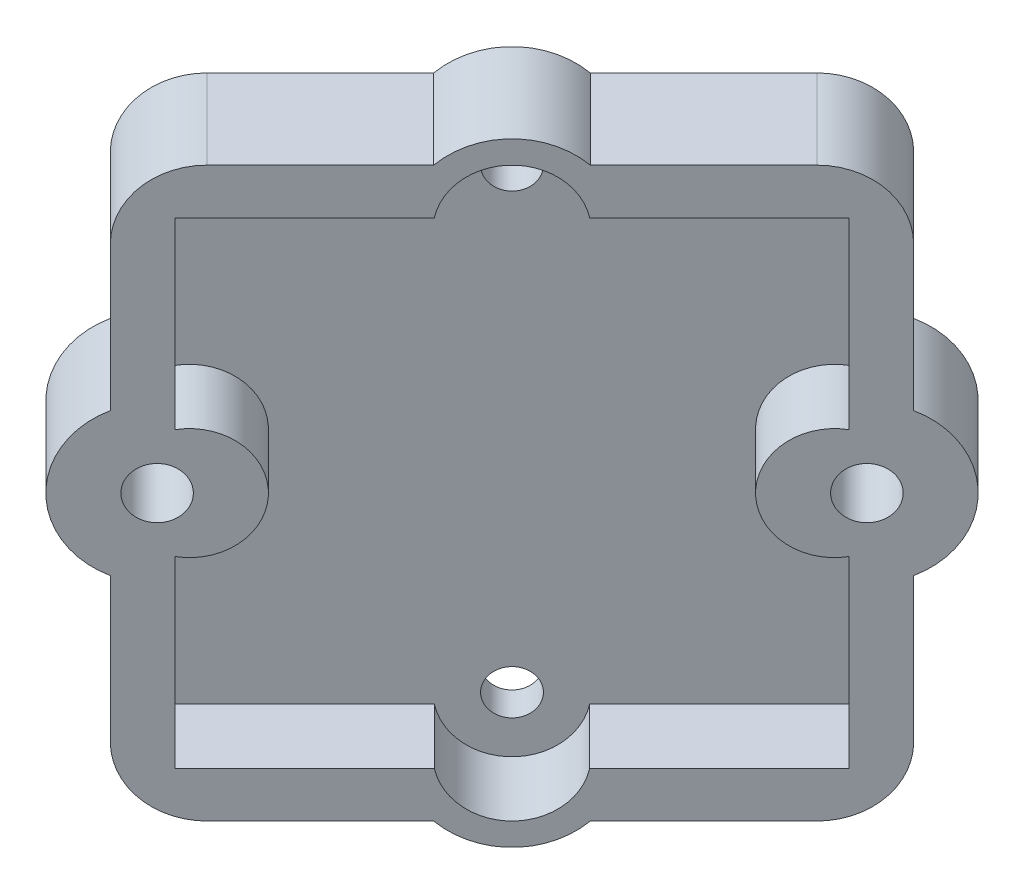
from build123d import *

# Parameters (mm, degrees)
BOSS_EXTRUDE1_DEPTH = 4.95
CUT_EXTRUDE1_DEPTH  = 3.45
CUT_EXTRUDE2_REACH  = 63.277
SKETCH3_R           = 0.975
CUT_EXTRUDE3_REACH  = 63.319
SKETCH4_R           = 1.125


with BuildPart() as part:
    # Sketch1 → Boss-Extrude1 (new body)
    with BuildSketch(Plane(origin=(69.394235316, 0, 69.394235316), x_dir=(0.7071067811865475, 0, -0.7071067811865477), z_dir=(0.7071067811865477, 0, 0.7071067811865475))):
        with BuildLine():
            Line((23.501825189, 8.05), (23.501825189, 14.369504832))
            ThreePointArc((23.501825189, 14.369504832), (21.501825189, 17.5), (23.501825189, 20.630495168))
            Line((23.501825189, 20.630495168), (23.501825189, 26.95))
            ThreePointArc((23.501825189, 26.95), (24.380504846, 29.071320344), (26.501825189, 29.95))
            Line((26.501825189, 29.95), (33.522833629, 29.95))
            ThreePointArc((33.522833629, 29.95), (35.951825189, 30.95), (38.38081675, 29.95))
            Line((38.38081675, 29.95), (45.401825189, 29.95))
            ThreePointArc((45.401825189, 29.95), (47.523145533, 29.071320344), (48.401825189, 26.95))
            Line((48.401825189, 26.95), (48.401825189, 20.630495168))
            ThreePointArc((48.401825189, 20.630495168), (50.401825189, 17.5), (48.401825189, 14.369504832))
            Line((48.401825189, 14.369504832), (48.401825189, 8.05))
            ThreePointArc((48.401825189, 8.05), (47.523145533, 5.928679656), (45.401825189, 5.05))
            Line((45.401825189, 5.05), (38.38081675, 5.05))
            ThreePointArc((38.38081675, 5.05), (35.951825189, 4.05), (33.522833629, 5.05))
            Line((33.522833629, 5.05), (26.501825189, 5.05))
            ThreePointArc((26.501825189, 5.05), (24.380504846, 5.928679656), (23.501825189, 8.05))
        make_face()
    extrude(amount=BOSS_EXTRUDE1_DEPTH)

    # Sketch2 → Cut-Extrude1 (cut)
    with BuildSketch(Plane(origin=(72.894413883, 0, 72.894413883), x_dir=(0.7071067811865476, 0, -0.7071067811865476), z_dir=(0.7071067811865476, 0, 0.7071067811865476))):
        with BuildLine():
            Line((38.360144105, 27.95), (46.401825189, 27.95))
            Line((46.401825189, 27.95), (46.401825189, 19.908318916))
            ThreePointArc((46.401825189, 19.908318916), (43.501825189, 17.5), (46.401825189, 15.091681084))
            Line((46.401825189, 15.091681084), (46.401825189, 7.05))
            Line((46.401825189, 7.05), (38.360144105, 7.05))
            ThreePointArc((38.360144105, 7.05), (35.951825189, 5.05), (33.543506273, 7.05))
            Line((33.543506273, 7.05), (25.501825189, 7.05))
            Line((25.501825189, 7.05), (25.501825189, 15.091681084))
            ThreePointArc((25.501825189, 15.091681084), (28.401825189, 17.5), (25.501825189, 19.908318916))
            Line((25.501825189, 19.908318916), (25.501825189, 27.95))
            Line((25.501825189, 27.95), (33.543506273, 27.95))
            ThreePointArc((33.543506273, 27.95), (35.951825189, 29.95), (38.360144105, 27.95))
        make_face()
    extrude(amount=-CUT_EXTRUDE1_DEPTH, mode=Mode.SUBTRACT)

    # Sketch3 → Cut-Extrude2 (cut, up to next)
    with BuildSketch(Plane(origin=(70.454895488, 0, 70.454895488), x_dir=(0.7071067811865475, 0, -0.7071067811865477), z_dir=(0.7071067811865477, 0, 0.7071067811865475)), mode=Mode.PRIVATE) as cut_extrude2_sk1:
        with Locations((35.951825189, 27.5)):
            Circle(SKETCH3_R)
    cut_extrude2_tool1 = extrude(cut_extrude2_sk1.sketch, amount=-CUT_EXTRUDE2_REACH, mode=Mode.PRIVATE) & part.part
    # Sketch3 → Cut-Extrude2 (cut, up to next)
    with BuildSketch(Plane(origin=(70.454895488, 0, 70.454895488), x_dir=(0.7071067811865475, 0, -0.7071067811865477), z_dir=(0.7071067811865477, 0, 0.7071067811865475)), mode=Mode.PRIVATE) as cut_extrude2_sk2:
        with Locations((35.951825189, 7.5)):
            Circle(SKETCH3_R)
    cut_extrude2_tool2 = extrude(cut_extrude2_sk2.sketch, amount=-CUT_EXTRUDE2_REACH, mode=Mode.PRIVATE) & part.part
    add(cut_extrude2_tool1.solids().sort_by_distance((95.876675, 27.5, 45.033116))[0], mode=Mode.SUBTRACT)
    add(cut_extrude2_tool2.solids().sort_by_distance((95.876675, 7.5, 45.033116))[0], mode=Mode.SUBTRACT)

    # Sketch4 → Cut-Extrude3 (cut, up to next)
    with BuildSketch(Plane(origin=(72.894413883, 0, 72.894413883), x_dir=(0.7071067811865476, 0, -0.7071067811865476), z_dir=(0.7071067811865476, 0, 0.7071067811865476)), mode=Mode.PRIVATE) as cut_extrude3_sk1:
        with Locations((24.951825189, 17.5)):
            Circle(SKETCH4_R)
    cut_extrude3_tool1 = extrude(cut_extrude3_sk1.sketch, amount=-CUT_EXTRUDE3_REACH, mode=Mode.PRIVATE) & part.part
    # Sketch4 → Cut-Extrude3 (cut, up to next)
    with BuildSketch(Plane(origin=(72.894413883, 0, 72.894413883), x_dir=(0.7071067811865476, 0, -0.7071067811865476), z_dir=(0.7071067811865476, 0, 0.7071067811865476)), mode=Mode.PRIVATE) as cut_extrude3_sk2:
        with Locations((46.951825189, 17.5)):
            Circle(SKETCH4_R)
    cut_extrude3_tool2 = extrude(cut_extrude3_sk2.sketch, amount=-CUT_EXTRUDE3_REACH, mode=Mode.PRIVATE) & part.part
    add(cut_extrude3_tool1.solids().sort_by_distance((90.538019, 17.5, 55.250809))[0], mode=Mode.SUBTRACT)
    add(cut_extrude3_tool2.solids().sort_by_distance((106.094368, 17.5, 39.69446))[0], mode=Mode.SUBTRACT)


solid = part.part
